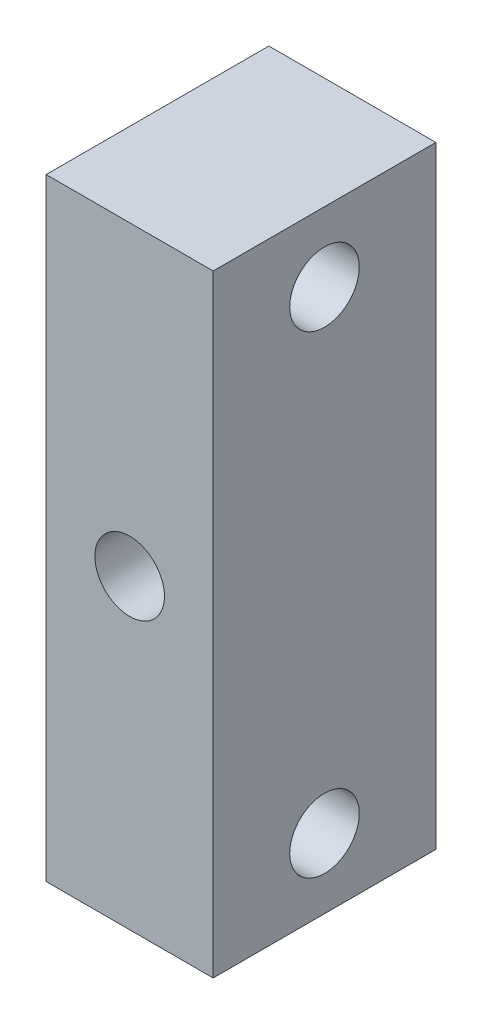
from build123d import *

# Parameters (mm, degrees)
SKETCH_1_W          = 6
SKETCH_1_H          = 8
EXTRUDE_1_DEPTH     = 11
SKETCH_2_R          = 1.25
CUT_EXTRUDE_1_DEPTH = 14.928388277
SKETCH_3_R          = 1.25
CUT_EXTRUDE_2_DEPTH = 14.152946438


with BuildPart() as part:
    # 草图1 → 凸台-拉伸1 (new, symmetric)
    with BuildSketch(Plane(origin=(0, 0, 0), x_dir=(1, 0, 0), z_dir=(0, 1, 0))):
        Rectangle(SKETCH_1_W, SKETCH_1_H)
    extrude(amount=EXTRUDE_1_DEPTH, both=True)

    # 草图2 → 切除-拉伸1 (cut, through all)
    with BuildSketch(Plane.XY.offset(4)):
        Circle(SKETCH_2_R)
    extrude(amount=-CUT_EXTRUDE_1_DEPTH, mode=Mode.SUBTRACT)

    # 草图3 → 切除-拉伸2 (cut, through all)
    with BuildSketch(Plane.ZY.offset(3)):
        with Locations((0, 8.5)):
            Circle(SKETCH_3_R)
        with Locations((0, -8.5)):
            Circle(SKETCH_3_R)
    extrude(amount=-CUT_EXTRUDE_2_DEPTH, mode=Mode.SUBTRACT)


solid = part.part
